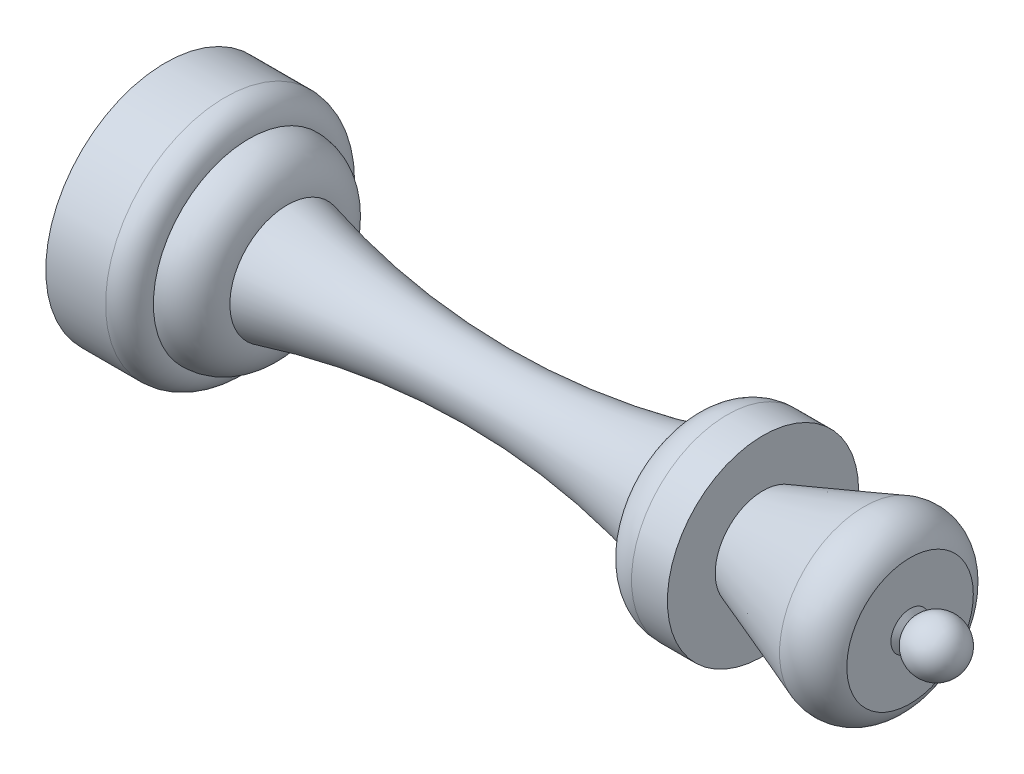
from build123d import *


with BuildPart() as part:
    # Sketch 153 → Повернуть1 (revolve)
    with BuildSketch(Plane(origin=(0, 0, 0), x_dir=(1, 0, 0), z_dir=(0, 1, 0))):
        Polygon((0, 10), (0, 0), (1, 0), (1, 5.25), (3.5, 5.25), (3.5, 0), (5, 0), (5, 10), align=None)
        with BuildLine():
            ThreePointArc((7, 8), (6.414213562, 9.414213562), (5, 10))
            Line((5, 10), (5, 0))
            Line((5, 0), (7, 0))
            Line((7, 0), (7, 8))
        make_face()
        with BuildLine():
            ThreePointArc((10.2, 4.8), (9.2627417, 7.0627417), (7, 8))
            Line((7, 8), (7, 0))
            Line((7, 0), (10.2, 0))
            Line((10.2, 0), (10.2, 4.8))
        make_face()
    revolve(axis=Axis((5, 0, 0), (-1, 0, 0)))

    # Sketch 880 → Повернуть2 (revolve)
    with BuildSketch(Plane(origin=(0, 0, 0), x_dir=(1, 0, 0), z_dir=(0, 1, 0))):
        with BuildLine():
            Line((10.2, 4.8), (10.2, 0))
            Line((10.2, 0), (66.7, 0))
            ThreePointArc((66.7, 0), (65.069401899, 2.125036818), (62.594744112, 1.1))
            Line((62.594744112, 1.1), (62.3, 1.6))
            Line((62.3, 1.6), (62.3, 5.291657255))
            ThreePointArc((62.3, 5.291657255), (60.748015293, 6.979485771), (58.457233587, 7.07818129))
            Line((58.457233587, 7.07818129), (50, 4))
            Line((50, 4), (50, 8))
            Line((50, 8), (47, 8))
            ThreePointArc((47, 8), (44.7372583, 7.0627417), (43.8, 4.8))
            ThreePointArc((43.8, 4.8), (27, 2.591400685), (10.2, 4.8))
        make_face()
    revolve(axis=Axis((50, 0, 0), (-1, 0, 0)))


solid = part.part
